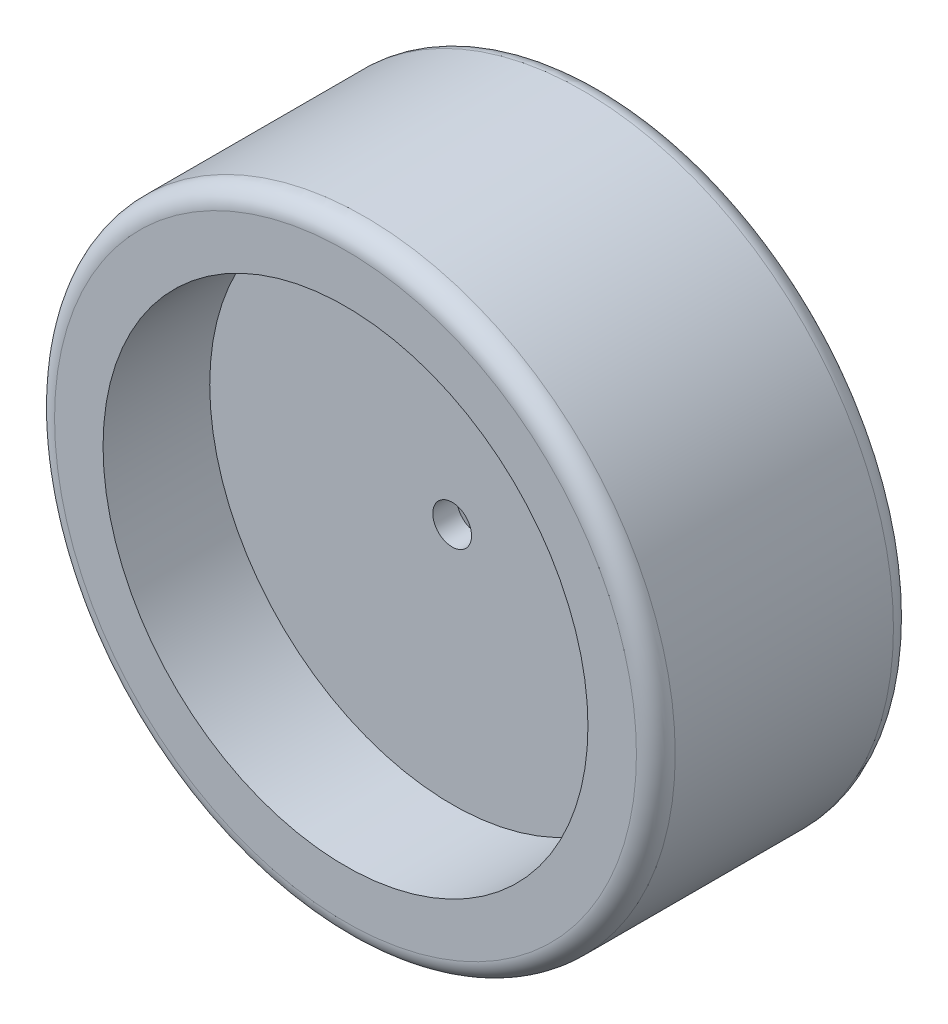
from build123d import *

# Parameters (mm, degrees)
EXTRUDE_START   = 1
SKETCH_1_R      = 25
EXTRUDE_1_DEPTH = 4
SKETCH_4_R      = 25
SKETCH_4_R_2    = 2
EXTRUDE_3_DEPTH = 2.5
EXTRUDE_START_2 = -15.5
SKETCH_6_R      = 32
SKETCH_6_R_2    = 25
EXTRUDE_4_DEPTH = 26.5
FILLET_1_R      = 2


with BuildPart() as part:
    # 草图1 → 凸台-拉伸1 (new body)
    with BuildSketch(Plane.XY.offset(EXTRUDE_START)):
        Circle(SKETCH_1_R)
        Polygon((3.464101615, 6), (-3.464101615, 6), (-6.92820323, 0), (-3.464101615, -6), (3.464101615, -6), (6.92820323, 0), align=None, mode=Mode.SUBTRACT)
    extrude(amount=EXTRUDE_1_DEPTH)

    # 草图4 → 凸台-拉伸3 (add)
    with BuildSketch(Plane.XY.offset(5)):
        Circle(SKETCH_4_R)
        Circle(SKETCH_4_R_2, mode=Mode.SUBTRACT)
    extrude(amount=EXTRUDE_3_DEPTH)

    # 草图6 → 凸台-拉伸4 (add)
    with BuildSketch(Plane.XY.offset(7.5).offset(EXTRUDE_START_2)):
        Circle(SKETCH_6_R)
        Circle(SKETCH_6_R_2, mode=Mode.SUBTRACT)
    extrude(amount=EXTRUDE_4_DEPTH)

    # 圆角1
    fillet_1_edges = [part.edges().sort_by_distance(p)[0] for p in [
        (-32, 0, -8),
        (-32, 0, 18.5),
    ]]
    fillet(fillet_1_edges, radius=FILLET_1_R)


solid = part.part
